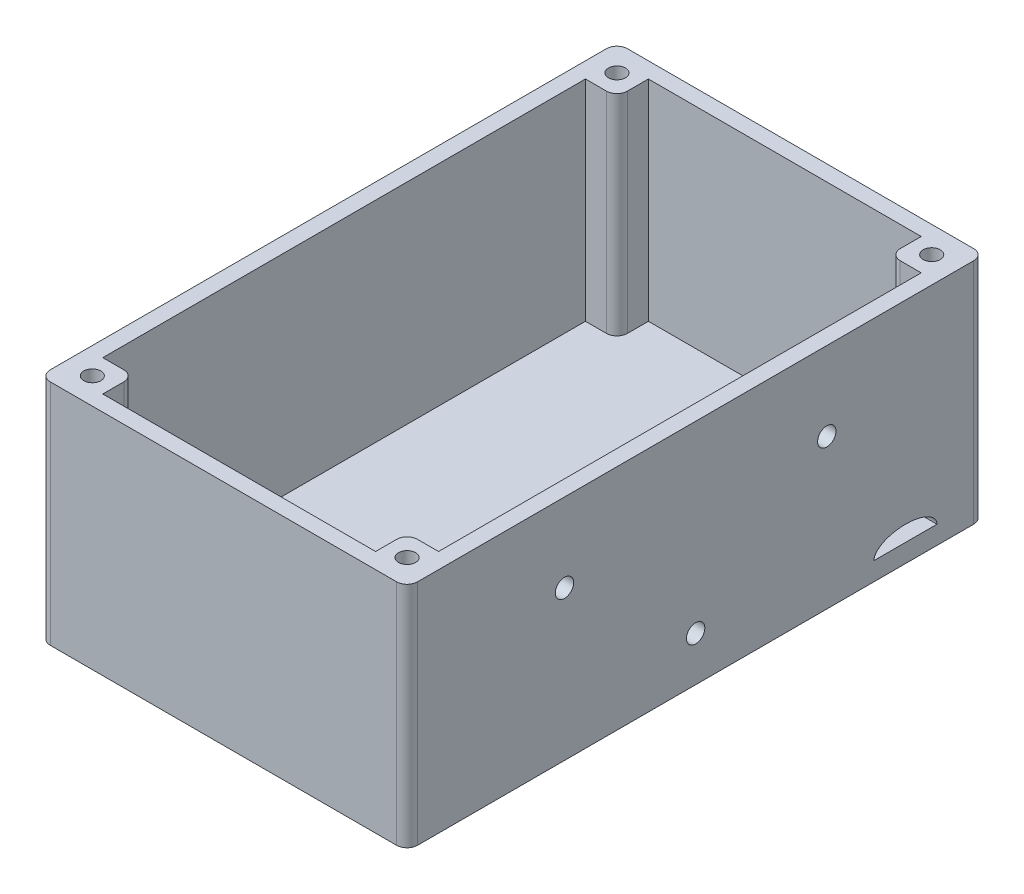
from build123d import *

# Parameters (mm, degrees)
SKETCH1_W                             = 70
SKETCH1_H                             = 110
BOTTOM_DEPTH                          = 3.5
SKETCH3_W                             = 70
SKETCH3_H                             = 110
WALL_DEPTH                            = 40
SKETCH4_R                             = 1.625
TOP_PLATE_SCREW_HOLES_DEPTH           = 30
TOP_PLATE_SCREW_HOLES_DRAFT           = -1
TOP_PLATE_SCREW_HOLES_PROFILE_2_DEPTH = 30
TOP_PLATE_SCREW_HOLES_PROFILE_2_DRAFT = -1
TOP_PLATE_SCREW_HOLES_PROFILE_3_DEPTH = 30
TOP_PLATE_SCREW_HOLES_PROFILE_3_DRAFT = -1
TOP_PLATE_SCREW_HOLES_PROFILE_4_DEPTH = 30
TOP_PLATE_SCREW_HOLES_PROFILE_4_DRAFT = -1
FILLET1_R                             = 2
FILLET2_R                             = 2
FILLET3_R                             = 2
FILLET4_R                             = 2
FILLET5_R                             = 2
FILLET6_R                             = 2
FILLET7_R                             = 2
FILLET8_R                             = 2
M4_MOUNT_R                            = 2.1
M4_MOUNT_CUT_DEPTH                    = 77.485292704
CABLE_PASS_CUT_DEPTH                  = 10
SKETCH6_R                             = 1.75
M3_CONNECTION_CUT_DEPTH               = 10


with BuildPart() as part:
    # Sketch1 → Bottom (new body)
    with BuildSketch(Plane(origin=(0, 0, 0), x_dir=(1, 0, 0), z_dir=(0, 1, 0))):
        Rectangle(SKETCH1_W, SKETCH1_H)
    extrude(amount=BOTTOM_DEPTH)

    # Sketch3 → Wall (add)
    with BuildSketch(Plane(origin=(0, 3.5, 0), x_dir=(1, 0, 0), z_dir=(0, 1, 0))):
        Rectangle(SKETCH3_W, SKETCH3_H)
        Polygon((-26, 52), (-4, 52), (26, 52), (26, 46), (32, 46), (32, -46), (26, -46), (26, -52), (4, -52), (-26, -52), (-26, -46), (-32, -46), (-32, 46), (-26, 46), align=None, mode=Mode.SUBTRACT)
    extrude(amount=WALL_DEPTH)


with BuildPart() as top_plate_screw_holes_tool:
    # Sketch4 → Top Plate Screw Holes (with draft: the straight prism first)
    with BuildSketch(Plane(origin=(0, 43.5, 0), x_dir=(1, 0, 0), z_dir=(0, 1, 0))):
        with Locations((-30, 50)):
            Circle(SKETCH4_R)
    extrude(amount=-TOP_PLATE_SCREW_HOLES_DEPTH)
    # Top Plate Screw Holes: the draft: its side faces are tilted about the plane it starts from
    top_plate_screw_holes_sides = [top_plate_screw_holes_tool.faces().sort_by_distance(p)[0] for p in [
        (-31.625, 28.5, -50),
    ]]
    draft(top_plate_screw_holes_sides, Plane(origin=(0, 43.5, 0), x_dir=(1, 0, 0), z_dir=(0, 1, 0)), TOP_PLATE_SCREW_HOLES_DRAFT)


with BuildPart() as part_1:
    add(part.part)

    # Top Plate Screw Holes: cut by top_plate_screw_holes_tool
    add(top_plate_screw_holes_tool.part, mode=Mode.SUBTRACT)


with BuildPart() as top_plate_screw_holes_profile_2_tool:
    # Sketch4 → Top Plate Screw Holes profile 2 (with draft: the straight prism first)
    with BuildSketch(Plane(origin=(0, 43.5, 0), x_dir=(1, 0, 0), z_dir=(0, 1, 0))):
        with Locations((30, 50)):
            Circle(SKETCH4_R)
    extrude(amount=-TOP_PLATE_SCREW_HOLES_PROFILE_2_DEPTH)
    # Top Plate Screw Holes profile 2: the draft: its side faces are tilted about the plane it starts from
    top_plate_screw_holes_profile_2_sides = [top_plate_screw_holes_profile_2_tool.faces().sort_by_distance(p)[0] for p in [
        (28.375, 28.5, -50),
    ]]
    draft(top_plate_screw_holes_profile_2_sides, Plane(origin=(0, 43.5, 0), x_dir=(1, 0, 0), z_dir=(0, 1, 0)), TOP_PLATE_SCREW_HOLES_PROFILE_2_DRAFT)


with BuildPart() as part_2:
    add(part_1.part)

    # Top Plate Screw Holes profile 2: cut by top_plate_screw_holes_profile_2_tool
    add(top_plate_screw_holes_profile_2_tool.part, mode=Mode.SUBTRACT)


with BuildPart() as top_plate_screw_holes_profile_3_tool:
    # Sketch4 → Top Plate Screw Holes profile 3 (with draft: the straight prism first)
    with BuildSketch(Plane(origin=(0, 43.5, 0), x_dir=(1, 0, 0), z_dir=(0, 1, 0))):
        with Locations((30, -50)):
            Circle(SKETCH4_R)
    extrude(amount=-TOP_PLATE_SCREW_HOLES_PROFILE_3_DEPTH)
    # Top Plate Screw Holes profile 3: the draft: its side faces are tilted about the plane it starts from
    top_plate_screw_holes_profile_3_sides = [top_plate_screw_holes_profile_3_tool.faces().sort_by_distance(p)[0] for p in [
        (28.375, 28.5, 50),
    ]]
    draft(top_plate_screw_holes_profile_3_sides, Plane(origin=(0, 43.5, 0), x_dir=(1, 0, 0), z_dir=(0, 1, 0)), TOP_PLATE_SCREW_HOLES_PROFILE_3_DRAFT)


with BuildPart() as part_3:
    add(part_2.part)

    # Top Plate Screw Holes profile 3: cut by top_plate_screw_holes_profile_3_tool
    add(top_plate_screw_holes_profile_3_tool.part, mode=Mode.SUBTRACT)


with BuildPart() as top_plate_screw_holes_profile_4_tool:
    # Sketch4 → Top Plate Screw Holes profile 4 (with draft: the straight prism first)
    with BuildSketch(Plane(origin=(0, 43.5, 0), x_dir=(1, 0, 0), z_dir=(0, 1, 0))):
        with Locations((-30, -50)):
            Circle(SKETCH4_R)
    extrude(amount=-TOP_PLATE_SCREW_HOLES_PROFILE_4_DEPTH)
    # Top Plate Screw Holes profile 4: the draft: its side faces are tilted about the plane it starts from
    top_plate_screw_holes_profile_4_sides = [top_plate_screw_holes_profile_4_tool.faces().sort_by_distance(p)[0] for p in [
        (-31.625, 28.5, 50),
    ]]
    draft(top_plate_screw_holes_profile_4_sides, Plane(origin=(0, 43.5, 0), x_dir=(1, 0, 0), z_dir=(0, 1, 0)), TOP_PLATE_SCREW_HOLES_PROFILE_4_DRAFT)


with BuildPart() as part_4:
    add(part_3.part)

    # Top Plate Screw Holes profile 4: cut by top_plate_screw_holes_profile_4_tool
    add(top_plate_screw_holes_profile_4_tool.part, mode=Mode.SUBTRACT)

    # Fillet1
    fillet1_edges = [part_4.edges().sort_by_distance(p)[0] for p in [
        (-26, 23.5, 46),
    ]]
    fillet(fillet1_edges, radius=FILLET1_R)

    # Fillet2
    fillet2_edges = [part_4.edges().sort_by_distance(p)[0] for p in [
        (26, 23.5, 46),
    ]]
    fillet(fillet2_edges, radius=FILLET2_R)

    # Fillet3
    fillet3_edges = [part_4.edges().sort_by_distance(p)[0] for p in [
        (26, 23.5, -46),
    ]]
    fillet(fillet3_edges, radius=FILLET3_R)

    # Fillet4
    fillet4_edges = [part_4.edges().sort_by_distance(p)[0] for p in [
        (-26, 23.5, -46),
    ]]
    fillet(fillet4_edges, radius=FILLET4_R)

    # Fillet5
    fillet5_edges = [part_4.edges().sort_by_distance(p)[0] for p in [
        (-35, 21.75, -55),
    ]]
    fillet(fillet5_edges, radius=FILLET5_R)

    # Fillet6
    fillet6_edges = [part_4.edges().sort_by_distance(p)[0] for p in [
        (35, 21.75, -55),
    ]]
    fillet(fillet6_edges, radius=FILLET6_R)

    # Fillet7
    fillet7_edges = [part_4.edges().sort_by_distance(p)[0] for p in [
        (35, 21.75, 55),
    ]]
    fillet(fillet7_edges, radius=FILLET7_R)

    # Fillet8
    fillet8_edges = [part_4.edges().sort_by_distance(p)[0] for p in [
        (-35, 21.75, 55),
    ]]
    fillet(fillet8_edges, radius=FILLET8_R)

    # M4 Mount → M4 Mount Cut (cut, through all)
    with BuildSketch(Plane.XZ.offset(-3.5)):
        with Locations(Location((0, -20, 0), (0, 0, 270))):
            Circle(M4_MOUNT_R)
        with Locations(Location((0, 20, 0), (0, 0, 270))):
            Circle(M4_MOUNT_R)
    extrude(amount=M4_MOUNT_CUT_DEPTH, mode=Mode.SUBTRACT)

    # M4 Screw CUT cone 1 section (through the dimple's axis) → M4 Screw CUT (revolve, cut)
    with BuildSketch(Plane(origin=(0, 3.5, 20), x_dir=(0, 0, 1), z_dir=(1, 0, 0))):
        Polygon((0, 0), (3.75, 0), (0, 3.75), align=None)
    revolve(axis=Axis((0, 3.5, 20), (0, -1, 0)), mode=Mode.SUBTRACT)

    # M4 Screw CUT cone 2 section (through the dimple's axis) → M4 Screw CUT cone 2 (revolve, cut)
    with BuildSketch(Plane(origin=(0, 3.5, -20), x_dir=(0, 0, 1), z_dir=(1, 0, 0))):
        Polygon((0, 0), (3.75, 0), (0, 3.75), align=None)
    revolve(axis=Axis((0, 3.5, -20), (0, -1, 0)), mode=Mode.SUBTRACT)

    # Sketch5 → Cable Pass CUT (cut)
    with BuildSketch(Plane.ZY.offset(-32)):
        with BuildLine():
            Line((-46, 3.5), (-34, 3.5))
            add(Edge.make_bspline(
                [(-34, 3.5), (-34, 6.5), (-40, 6.5), (-46, 6.5), (-46, 3.5)],
                knots=[0, 0, 0, 1.570796327, 1.570796327, 3.141592654, 3.141592654, 3.141592654], degree=2, weights=[1, 0.707106781, 1, 0.707106781, 1]))
        make_face()
    extrude(amount=-CABLE_PASS_CUT_DEPTH, mode=Mode.SUBTRACT)

    # Sketch6 → M3 Connection CUT (cut)
    with BuildSketch(Plane.ZY.offset(-32)):
        with Locations((-25, 28.5)):
            Circle(SKETCH6_R)
        with Locations((25, 28.5)):
            Circle(SKETCH6_R)
        with Locations((0, 8.5)):
            Circle(SKETCH6_R)
    extrude(amount=-M3_CONNECTION_CUT_DEPTH, mode=Mode.SUBTRACT)


solid = part_4.part
